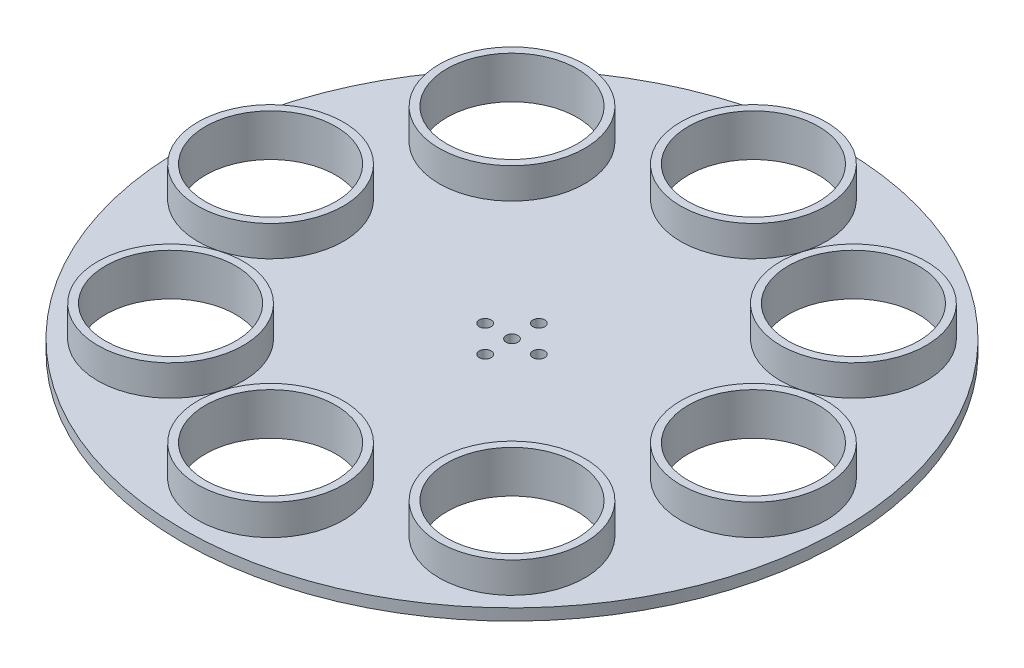
from build123d import *

# Parameters (mm, degrees)
SKETCH_1_R        = 19
SKETCH_1_R_2      = 17
EXTRUDE_2_DEPTH   = 11
EXTRUDE_2_2_DEPTH = 11
EXTRUDE_2_3_DEPTH = 11
EXTRUDE_2_4_DEPTH = 11
EXTRUDE_2_5_DEPTH = 11
EXTRUDE_2_6_DEPTH = 11
EXTRUDE_2_7_DEPTH = 11
EXTRUDE_2_8_DEPTH = 11
SKETCH_1_8_R      = 86
SKETCH_1_8_R_2    = 19
SKETCH_1_8_R_3    = 1.55
EXTRUDE_3_DEPTH   = 3


with BuildPart() as part:
    # 草图1 → 凸台-拉伸2 (new body)
    with BuildSketch(Plane(origin=(0, 0, 0), x_dir=(1, 0, 0), z_dir=(0, 1, 0))):
        with Locations((-44.544339366, 44.544339366)):
            Circle(SKETCH_1_R)
        with Locations((-44.544339366, 44.544339366)):
            Circle(SKETCH_1_R_2, mode=Mode.SUBTRACT)
    extrude(amount=EXTRUDE_2_DEPTH)



with BuildPart() as body_2:
    # 草图1 → Extrude 2 2 (new body)
    with BuildSketch(Plane(origin=(0, 0, 0), x_dir=(1, 0, 0), z_dir=(0, 1, 0))):
        with Locations((0, 63)):
            Circle(SKETCH_1_R)
        with Locations((0, 63)):
            Circle(SKETCH_1_R_2, mode=Mode.SUBTRACT)
    extrude(amount=EXTRUDE_2_2_DEPTH)


with BuildPart() as body_3:
    # 草图1 → Extrude 2 3 (new body)
    with BuildSketch(Plane(origin=(0, 0, 0), x_dir=(1, 0, 0), z_dir=(0, 1, 0))):
        with Locations((44.547727215, 44.547727215)):
            Circle(SKETCH_1_R)
        with Locations((44.547727215, 44.547727215)):
            Circle(SKETCH_1_R_2, mode=Mode.SUBTRACT)
    extrude(amount=EXTRUDE_2_3_DEPTH)


with BuildPart() as body_4:
    # 草图1 → Extrude 2 4 (new body)
    with BuildSketch(Plane(origin=(0, 0, 0), x_dir=(1, 0, 0), z_dir=(0, 1, 0))):
        with Locations((63, 0)):
            Circle(SKETCH_1_R)
        with Locations((63, 0)):
            Circle(SKETCH_1_R_2, mode=Mode.SUBTRACT)
    extrude(amount=EXTRUDE_2_4_DEPTH)


with BuildPart() as body_5:
    # 草图1 → Extrude 2 5 (new body)
    with BuildSketch(Plane(origin=(0, 0, 0), x_dir=(1, 0, 0), z_dir=(0, 1, 0))):
        with Locations((44.547727215, -44.547727215)):
            Circle(SKETCH_1_R)
        with Locations((44.547727215, -44.547727215)):
            Circle(SKETCH_1_R_2, mode=Mode.SUBTRACT)
    extrude(amount=EXTRUDE_2_5_DEPTH)


with BuildPart() as body_6:
    # 草图1 → Extrude 2 6 (new body)
    with BuildSketch(Plane(origin=(0, 0, 0), x_dir=(1, 0, 0), z_dir=(0, 1, 0))):
        with Locations((0, -63)):
            Circle(SKETCH_1_R)
        with Locations((0, -63)):
            Circle(SKETCH_1_R_2, mode=Mode.SUBTRACT)
    extrude(amount=EXTRUDE_2_6_DEPTH)


with BuildPart() as body_7:
    # 草图1 → Extrude 2 7 (new body)
    with BuildSketch(Plane(origin=(0, 0, 0), x_dir=(1, 0, 0), z_dir=(0, 1, 0))):
        with Locations((-44.547727215, -44.547727215)):
            Circle(SKETCH_1_R)
        with Locations((-44.547727215, -44.547727215)):
            Circle(SKETCH_1_R_2, mode=Mode.SUBTRACT)
    extrude(amount=EXTRUDE_2_7_DEPTH)


with BuildPart() as body_8:
    # 草图1 → Extrude 2 8 (new body)
    with BuildSketch(Plane(origin=(0, 0, 0), x_dir=(1, 0, 0), z_dir=(0, 1, 0))):
        with Locations((-63, 0)):
            Circle(SKETCH_1_R)
        with Locations((-63, 0)):
            Circle(SKETCH_1_R_2, mode=Mode.SUBTRACT)
    extrude(amount=EXTRUDE_2_8_DEPTH)


with BuildPart() as part_1:
    add(part.part)

    add(body_2.part)  # 凸台-拉伸3 merges body 2

    add(body_3.part)  # 凸台-拉伸3 merges body 3

    add(body_4.part)  # 凸台-拉伸3 merges body 4

    add(body_5.part)  # 凸台-拉伸3 merges body 5

    add(body_6.part)  # 凸台-拉伸3 merges body 6

    add(body_7.part)  # 凸台-拉伸3 merges body 7

    add(body_8.part)  # 凸台-拉伸3 merges body 8
    # 草图1<8> → 凸台-拉伸3 (add)
    with BuildSketch(Plane(origin=(0, 0, 0), x_dir=(1, 0, 0), z_dir=(0, 1, 0))):
        Circle(SKETCH_1_8_R)
        with Locations((-44.547727215, -44.547727215)):
            Circle(SKETCH_1_8_R_2, mode=Mode.SUBTRACT)
        with Locations((0, -63)):
            Circle(SKETCH_1_8_R_2, mode=Mode.SUBTRACT)
        with Locations((44.547727215, -44.547727215)):
            Circle(SKETCH_1_8_R_2, mode=Mode.SUBTRACT)
        with Locations((0, -7)):
            Circle(SKETCH_1_8_R_3, mode=Mode.SUBTRACT)
        with Locations((-63, 0)):
            Circle(SKETCH_1_8_R_2, mode=Mode.SUBTRACT)
        with Locations((-7, 0)):
            Circle(SKETCH_1_8_R_3, mode=Mode.SUBTRACT)
        with Locations((-44.544339366, 44.544339366)):
            Circle(SKETCH_1_8_R_2, mode=Mode.SUBTRACT)
        Circle(SKETCH_1_8_R_3, mode=Mode.SUBTRACT)
        with Locations((7, 0)):
            Circle(SKETCH_1_8_R_3, mode=Mode.SUBTRACT)
        with Locations((0, 7)):
            Circle(SKETCH_1_8_R_3, mode=Mode.SUBTRACT)
        with Locations((63, 0)):
            Circle(SKETCH_1_8_R_2, mode=Mode.SUBTRACT)
        with Locations((0, 63)):
            Circle(SKETCH_1_8_R_2, mode=Mode.SUBTRACT)
        with Locations((44.547727215, 44.547727215)):
            Circle(SKETCH_1_8_R_2, mode=Mode.SUBTRACT)
    extrude(amount=EXTRUDE_3_DEPTH)


solid = part_1.part
